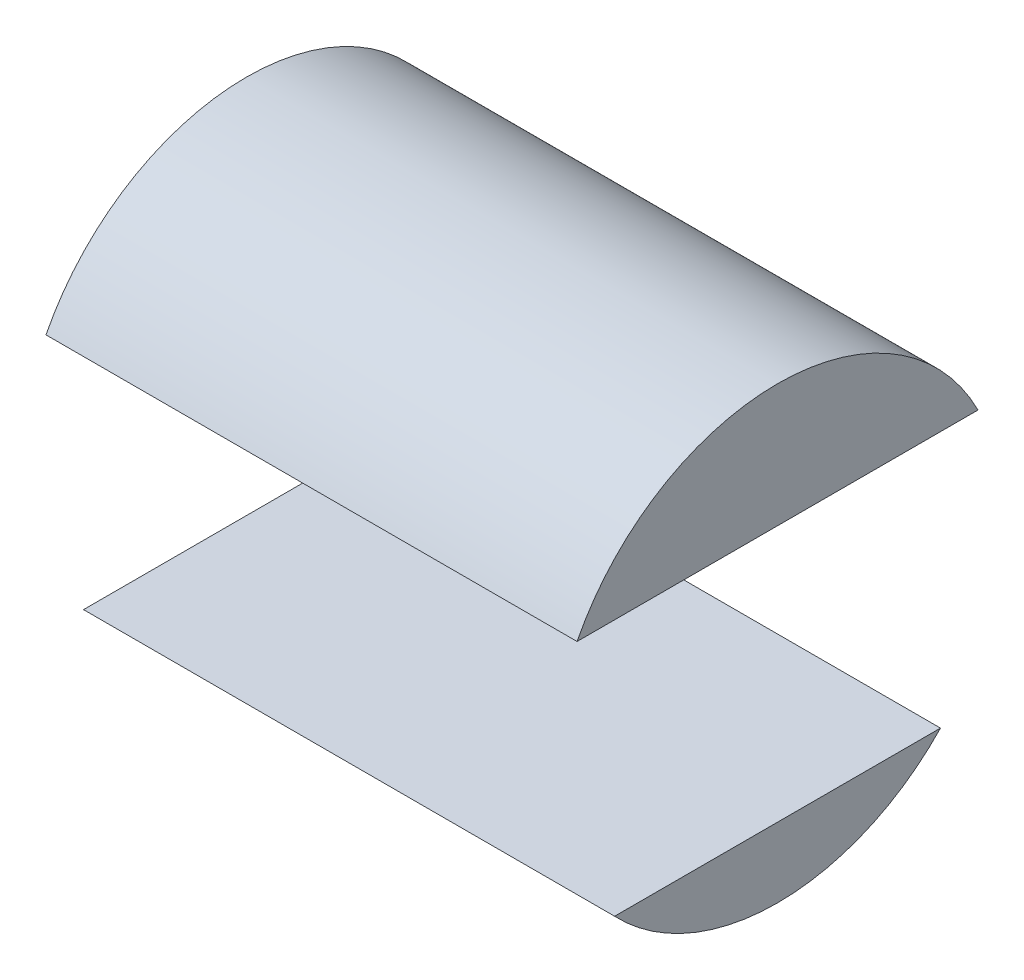
from build123d import *

# Parameters (mm, degrees)
SKETCH1_R           = 50.8
SKETCH1_W           = 60
SKETCH1_H           = 58
BOSS_EXTRUDE1_DEPTH = 120
CUT_EXTRUDE1_DEPTH  = 140.861645922


with BuildPart() as part:
    # Sketch1 → Boss-Extrude1 (new body)
    with BuildSketch(Plane(origin=(0, 0, 0), x_dir=(0, 0, -1), z_dir=(1, 0, 0))):
        Circle(SKETCH1_R)
        with Locations((0, -6)):
            Rectangle(SKETCH1_W, SKETCH1_H, mode=Mode.SUBTRACT)
    extrude(amount=BOSS_EXTRUDE1_DEPTH)

    # Sketch4 → Cut-Extrude1 (cut, through all)
    with BuildSketch(Plane(origin=(120, 0, 0), x_dir=(0, 0, -1), z_dir=(1, 0, 0))):
        with BuildLine():
            Line((45.29503284, 23), (-45.29503284, 23))
            ThreePointArc((-45.29503284, 23), (-50.26608487, -7.345795523), (-36.819016826, -35))
            Line((-36.819016826, -35), (36.819016826, -35))
            ThreePointArc((36.819016826, -35), (50.26608487, -7.345795523), (45.29503284, 23))
        make_face()
    extrude(amount=-CUT_EXTRUDE1_DEPTH, mode=Mode.SUBTRACT)


with BuildPart() as cut_extrude1_piece_1:
    # of the separate pieces the step leaves, piece 1, a body of its own (cut_extrude1_pieces)
    add(part.part.solids().sort_by_distance((0, 23, -45.29503284))[0])


with BuildPart() as cut_extrude1_piece_2:
    # of the separate pieces the step leaves, piece 2, a body of its own (cut_extrude1_pieces)
    add(part.part.solids().sort_by_distance((0, -35, 36.819016826))[0])


solid = Compound([cut_extrude1_piece_1.part, cut_extrude1_piece_2.part])
